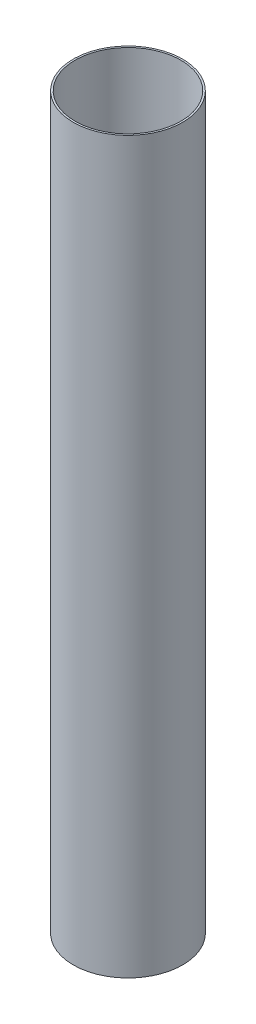
from build123d import *

# Parameters (mm, degrees)
SKETCH1_R           = 38.1
SKETCH1_R_2         = 36.83
BOSS_EXTRUDE1_DEPTH = 254


with BuildPart() as part:
    # Sketch1 → Boss-Extrude1 (new, symmetric)
    with BuildSketch(Plane(origin=(0, 0, 0), x_dir=(1, 0, 0), z_dir=(0, 1, 0))):
        with Locations(Location((0, 0, 0), (0, 0, 270))):
            Circle(SKETCH1_R)
        with Locations(Location((0, 0, 0), (0, 0, 270))):
            Circle(SKETCH1_R_2, mode=Mode.SUBTRACT)
    extrude(amount=BOSS_EXTRUDE1_DEPTH, both=True)


solid = part.part
